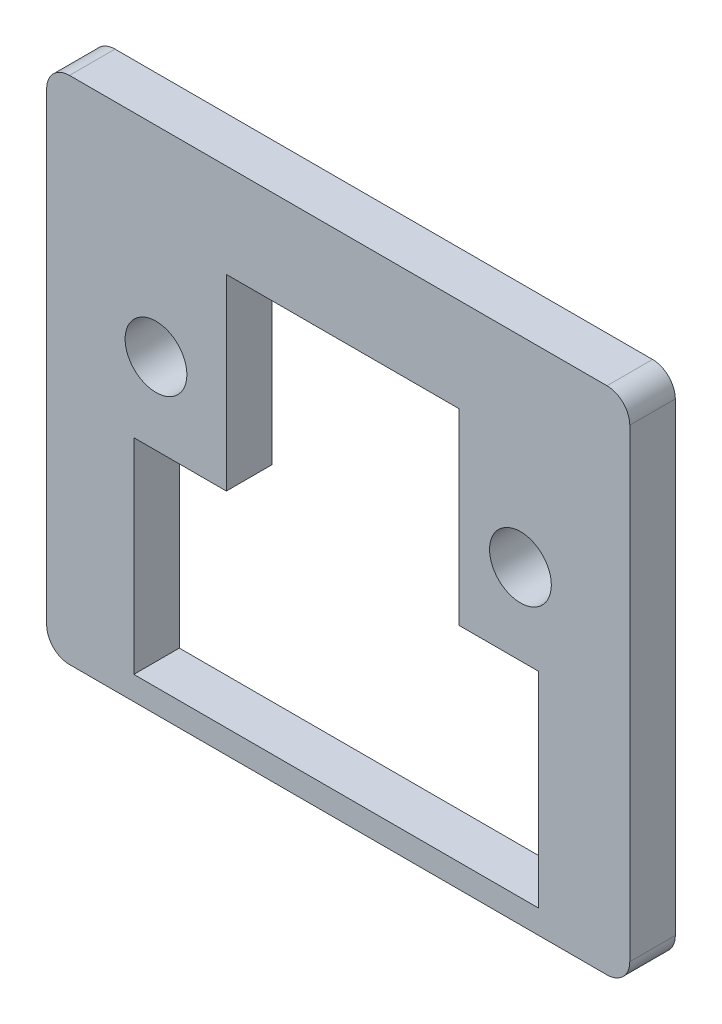
from build123d import *

# Parameters (mm, degrees)
SKETCH1_R           = 2.15265
BOSS_EXTRUDE1_DEPTH = 3.175
CUT_EXTRUDE1_DEPTH  = 55.094397353


with BuildPart() as part:
    # Sketch1 → Boss-Extrude1 (new body)
    with BuildSketch(Plane.XY):
        with BuildLine():
            Line((0, 1.5875), (0, 33.9725))
            ThreePointArc((0, 33.9725), (-0.464967985, 35.095032015), (-1.5875, 35.56))
            Line((-1.5875, 35.56), (-39.0525, 35.56))
            ThreePointArc((-39.0525, 35.56), (-40.175032015, 35.095032015), (-40.64, 33.9725))
            Line((-40.64, 33.9725), (-40.64, 1.5875))
            ThreePointArc((-40.64, 1.5875), (-40.175032015, 0.464967985), (-39.0525, 0))
            Line((-39.0525, 0), (-1.5875, 0))
            ThreePointArc((-1.5875, 0), (-0.464967985, 0.464967985), (0, 1.5875))
        make_face()
        with Locations((-7.62, 21.59)):
            Circle(SKETCH1_R, mode=Mode.SUBTRACT)
        with Locations((-33.02, 21.59)):
            Circle(SKETCH1_R, mode=Mode.SUBTRACT)
    extrude(amount=BOSS_EXTRUDE1_DEPTH)

    # Sketch2 → Cut-Extrude1 (cut, through all)
    with BuildSketch(Plane(origin=(0, 0, 0), x_dir=(-1, 0, 0), z_dir=(0, 0, -1))):
        Polygon((11.91856275, 15.939478953), (6.375346419, 15.939478953), (6.375346419, 1.648374352), (34.567798224, 1.648374352), (34.567798224, 15.939478953), (28.115147964, 15.939478953), (28.115147964, 29.018004982), (11.91856275, 29.018004982), align=None)
    extrude(amount=-CUT_EXTRUDE1_DEPTH, mode=Mode.SUBTRACT)


solid = part.part
